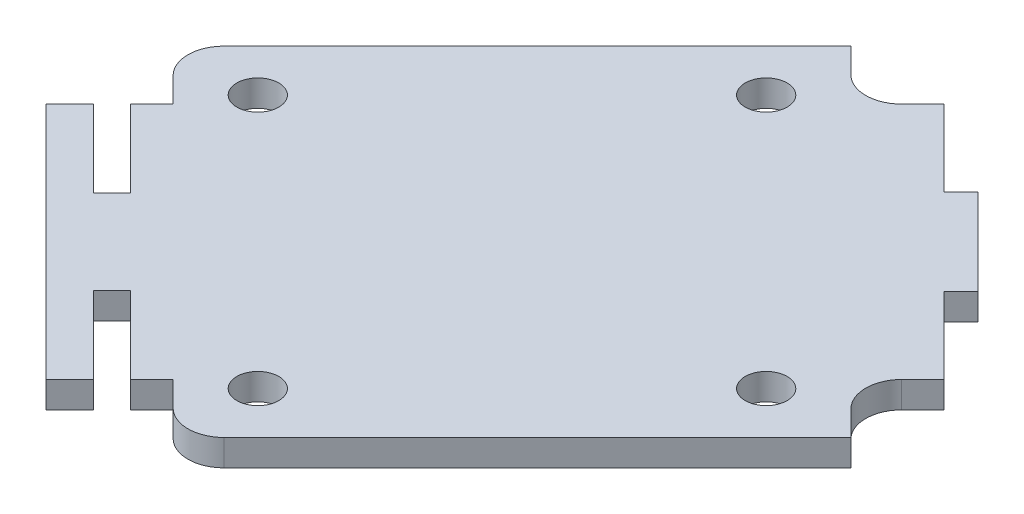
from build123d import *

# Parameters (mm, degrees)
SKETCH1_R           = 1.75
BOSS_EXTRUDE1_DEPTH = 2.2


with BuildPart() as part:
    # Sketch1 → Boss-Extrude1 (new body)
    with BuildSketch(Plane(origin=(0, 0, 0), x_dir=(1, 0, 0), z_dir=(0, 1, 0))):
        with BuildLine():
            Line((-32.452490814, -50.090677738), (-34.898824615, -52.53701154))
            Line((-34.898824615, -52.53701154), (-58.615441718, -76.253628642))
            ThreePointArc((-58.615441718, -76.253628642), (-59.494121374, -78.374948986), (-58.615441718, -80.496269329))
            Line((-58.615441718, -80.496269329), (-56.546018533, -82.565692514))
            Line((-56.546018533, -82.565692514), (-58.313785486, -84.333459467))
            Line((-58.313785486, -84.333459467), (-51.897927296, -90.749317656))
            Line((-51.897927296, -90.749317656), (-53.453562215, -92.304952575))
            Line((-53.453562215, -92.304952575), (-59.869420404, -85.889094386))
            Line((-59.869420404, -85.889094386), (-61.849319392, -87.868993373))
            Line((-61.849319392, -87.868993373), (-55.433461202, -94.284851562))
            Line((-55.433461202, -94.284851562), (-48.36239339, -101.355919374))
            Line((-48.36239339, -101.355919374), (-41.946535201, -107.771777564))
            Line((-41.946535201, -107.771777564), (-39.966636214, -105.791878576))
            Line((-39.966636214, -105.791878576), (-46.382494403, -99.376020387))
            Line((-46.382494403, -99.376020387), (-44.826859485, -97.820385468))
            Line((-44.826859485, -97.820385468), (-38.411001295, -104.236243658))
            Line((-38.411001295, -104.236243658), (-36.643234342, -102.468476705))
            Line((-36.643234342, -102.468476705), (-34.573811157, -104.53789989))
            ThreePointArc((-34.573811157, -104.53789989), (-32.452490814, -105.416579546), (-30.33117047, -104.53789989))
            Line((-30.33117047, -104.53789989), (-6.614553368, -80.821282787))
            Line((-6.614553368, -80.821282787), (-4.168219566, -78.374948986))
            Line((-4.168219566, -78.374948986), (-6.237642751, -76.305525801))
            ThreePointArc((-6.237642751, -76.305525801), (-7.116322408, -74.184205457), (-6.237642751, -72.062885114))
            Line((-6.237642751, -72.062885114), (-4.469875798, -70.295118161))
            Line((-4.469875798, -70.295118161), (-10.833836829, -63.93115713))
            Line((-10.833836829, -63.93115713), (-9.419623267, -62.516943568))
            Line((-9.419623267, -62.516943568), (-16.594485396, -55.342081438))
            Line((-16.594485396, -55.342081438), (-18.008698958, -56.756295001))
            Line((-18.008698958, -56.756295001), (-24.372659989, -50.39233397))
            Line((-24.372659989, -50.39233397), (-26.140426942, -52.160100923))
            ThreePointArc((-26.140426942, -52.160100923), (-28.261747285, -53.03878058), (-30.383067629, -52.160100923))
            Line((-30.383067629, -52.160100923), (-32.452490814, -50.090677738))
        make_face()
        with Locations(Location((-32.452490814, -99.588152421, 0), (0, 0, 270))):
            Circle(SKETCH1_R, mode=Mode.SUBTRACT)
        with Locations(Location((-53.665694249, -78.374948986, 0), (0, 0, 270))):
            Circle(SKETCH1_R, mode=Mode.SUBTRACT)
        with Locations(Location((-11.239287378, -78.374948986, 0), (0, 0, 270))):
            Circle(SKETCH1_R, mode=Mode.SUBTRACT)
        with Locations(Location((-32.452490814, -57.16174555, 0), (0, 0, 270))):
            Circle(SKETCH1_R, mode=Mode.SUBTRACT)
    extrude(amount=BOSS_EXTRUDE1_DEPTH)


solid = part.part
